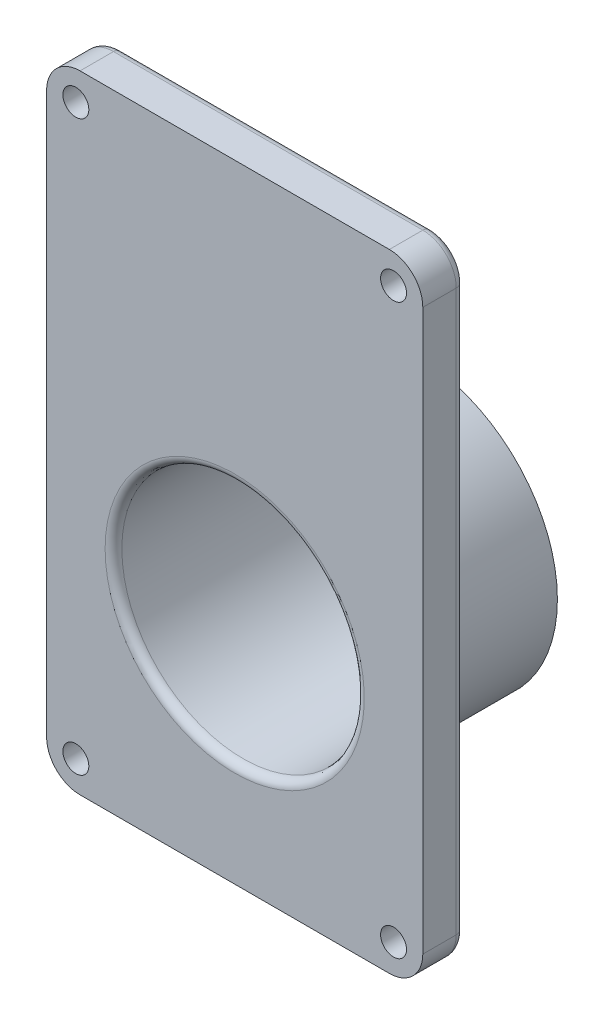
from build123d import *

# Parameters (mm, degrees)
SKETCH1_W           = 45
SKETCH1_H           = 75
BOSS_EXTRUDE1_DEPTH = 5
SKETCH2_R           = 1.55
SKETCH2_R_2         = 14.5
SKETCH2_R_3         = 10
CUT_EXTRUDE4_DEPTH  = 27.5
FILLET3_R           = 4
SKETCH3_R           = 16.8
SKETCH3_R_2         = 14.5
BOSS_EXTRUDE2_DEPTH = 16.8
FILLET4_R           = 2
FILLET5_R           = 1


with BuildPart() as part:
    # Sketch1 → Boss-Extrude1 (new body)
    with BuildSketch(Plane.XY):
        Rectangle(SKETCH1_W, SKETCH1_H)
    extrude(amount=BOSS_EXTRUDE1_DEPTH)

    # Sketch2 → Cut-Extrude4 (cut, symmetric)
    # profile 1 of 6: a face of its own
    with BuildSketch(Plane.XY.offset(5)):
        with Locations(Location((19, 34, 0), (0, 0, 180))):
            Circle(SKETCH2_R)
    # profile 2 of 6: a face of its own
    with BuildSketch(Plane.XY.offset(5)):
        with Locations(Location((-19, 34, 0), (0, 0, 180))):
            Circle(SKETCH2_R)
    # profile 3 of 6: a face of its own
    with BuildSketch(Plane.XY.offset(5)):
        with Locations(Location((19, -34, 0), (0, 0, 180))):
            Circle(SKETCH2_R)
    # profile 4 of 6: a face of its own
    with BuildSketch(Plane.XY.offset(5)):
        with Locations(Location((-19, -34, 0), (0, 0, 180))):
            Circle(SKETCH2_R)
    # profile 5 of 6: a face of its own
    with BuildSketch(Plane.XY.offset(5)):
        with Locations(Location((0, -10.5, 0), (0, 0, 180))):
            Circle(SKETCH2_R_2)
        with Locations((0, -10.5)):
            Circle(SKETCH2_R_3, mode=Mode.SUBTRACT)
    # profile 6 of 6: a face of its own
    with BuildSketch(Plane.XY.offset(5)):
        with Locations((0, -10.5)):
            Circle(SKETCH2_R_3)
    extrude(amount=CUT_EXTRUDE4_DEPTH, both=True, mode=Mode.SUBTRACT)

    # Fillet3
    fillet3_edges = [part.edges().sort_by_distance(p)[0] for p in [
        (-22.5, -37.5, 2.5),
        (-22.5, 37.5, 2.5),
        (22.5, 37.5, 2.5),
        (22.5, -37.5, 2.5),
    ]]
    fillet(fillet3_edges, radius=FILLET3_R)

    # Sketch3 → Boss-Extrude2 (add)
    with BuildSketch(Plane(origin=(0, 0, 0), x_dir=(-1, 0, 0), z_dir=(0, 0, -1))):
        with Locations((0, -10.5)):
            Circle(SKETCH3_R)
        with Locations((0, -10.5)):
            Circle(SKETCH3_R_2, mode=Mode.SUBTRACT)
    extrude(amount=BOSS_EXTRUDE2_DEPTH)

    # Fillet4
    fillet4_edges = [part.edges().sort_by_distance(p)[0] for p in [
        (16.8, -10.5, 0),
    ]]
    fillet(fillet4_edges, radius=FILLET4_R)

    # Fillet5
    fillet5_edges = [part.edges().sort_by_distance(p)[0] for p in [
        (14.5, -10.5, 5),
        (0, -37.5, 0),
        (-22.5, 0, 0),
        (0, 37.5, 0),
        (22.5, 0, 0),
        (-21.328427125, 36.328427125, 0),
        (21.328427125, 36.328427125, 0),
        (21.328427125, -36.328427125, 0),
        (-21.328427125, -36.328427125, 0),
    ]]
    fillet(fillet5_edges, radius=FILLET5_R)


solid = part.part
